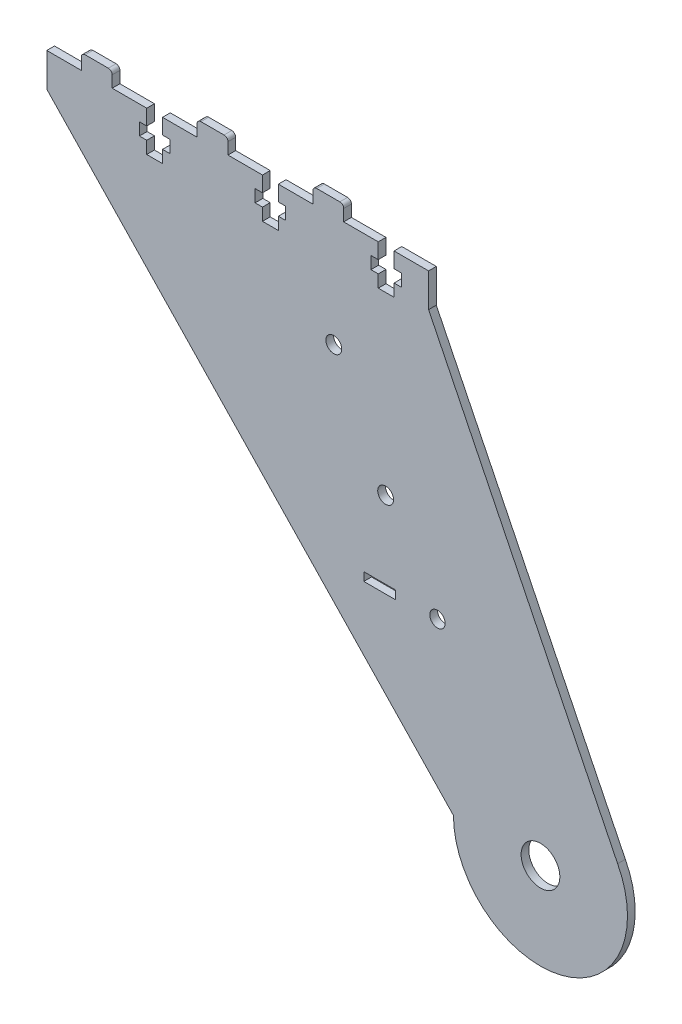
from build123d import *

# Parameters (mm, degrees)
SKETCH_1_R      = 2
SKETCH_1_R_2    = 5.02
SKETCH_1_R_3    = 2.05
SKETCH_1_W      = 8.2
SKETCH_1_H      = 2.2
EXTRUDE_1_DEPTH = 2
FILLET_1_R      = 1


with BuildPart() as part:
    # 草图1 → 凸台-拉伸1 (new body)
    with BuildSketch(Plane.XY):
        with BuildLine():
            Line((-38.25, 66.25), (-38.25, 62.25))
            Line((-38.25, 62.25), (-40.15, 62.25))
            Line((-40.15, 62.25), (-40.15, 59.05))
            Line((-40.15, 59.05), (-38.25, 59.05))
            Line((-38.25, 59.05), (-38.25, 55.85))
            Line((-38.25, 55.85), (-34.15, 55.85))
            Line((-34.15, 55.85), (-34.15, 59.05))
            Line((-34.15, 59.05), (-32.25, 59.05))
            Line((-32.25, 59.05), (-32.25, 62.25))
            Line((-32.25, 62.25), (-34.15, 62.25))
            Line((-34.15, 62.25), (-34.15, 66.25))
            Line((-34.15, 66.25), (-25.2, 66.25))
            Line((-25.2, 66.25), (-25.2, 70.25))
            Line((-25.2, 70.25), (-17.2, 70.25))
            Line((-17.2, 70.25), (-17.2, 66.25))
            Line((-17.2, 66.25), (-8.25, 66.25))
            Line((-8.25, 66.25), (-8.25, 62.25))
            Line((-8.25, 62.25), (-10.15, 62.25))
            Line((-10.15, 62.25), (-10.15, 59.05))
            Line((-10.15, 59.05), (-8.25, 59.05))
            Line((-8.25, 59.05), (-8.25, 55.85))
            Line((-8.25, 55.85), (-4.15, 55.85))
            Line((-4.15, 55.85), (-4.15, 59.05))
            Line((-4.15, 59.05), (-2.25, 59.05))
            Line((-2.25, 59.05), (-2.25, 62.25))
            Line((-2.25, 62.25), (-4.15, 62.25))
            Line((-4.15, 62.25), (-4.15, 66.25))
            Line((-4.15, 66.25), (4.8, 66.25))
            Line((4.8, 66.25), (4.8, 57.55))
            Line((4.8, 57.55), (53.793343317, -42.319549886))
            ThreePointArc((53.793343317, -42.319549886), (39.164608528, -74.656513398), (11.24, -52.75))
            Line((11.24, -52.75), (-94.15, 57.55))
            Line((-94.15, 57.55), (-94.15, 66.25))
            Line((-94.15, 66.25), (-85.2, 66.25))
            Line((-85.2, 66.25), (-85.2, 70.25))
            Line((-85.2, 70.25), (-77.2, 70.25))
            Line((-77.2, 70.25), (-77.2, 66.25))
            Line((-77.2, 66.25), (-68.25, 66.25))
            Line((-68.25, 66.25), (-68.25, 62.25))
            Line((-68.25, 62.25), (-70.15, 62.25))
            Line((-70.15, 62.25), (-70.15, 59.05))
            Line((-70.15, 59.05), (-68.25, 59.05))
            Line((-68.25, 59.05), (-68.25, 55.85))
            Line((-68.25, 55.85), (-64.15, 55.85))
            Line((-64.15, 55.85), (-64.15, 59.05))
            Line((-64.15, 59.05), (-62.25, 59.05))
            Line((-62.25, 59.05), (-62.25, 62.25))
            Line((-62.25, 62.25), (-64.15, 62.25))
            Line((-64.15, 62.25), (-64.15, 66.25))
            Line((-64.15, 66.25), (-55.2, 66.25))
            Line((-55.2, 66.25), (-55.2, 70.25))
            Line((-55.2, 70.25), (-47.2, 70.25))
            Line((-47.2, 70.25), (-47.2, 66.25))
            Line((-47.2, 66.25), (-38.25, 66.25))
        make_face()
        with Locations((7.098407643, -10.75)):
            Circle(SKETCH_1_R, mode=Mode.SUBTRACT)
        with Locations((33.795, -52.75)):
            Circle(SKETCH_1_R_2, mode=Mode.SUBTRACT)
        with Locations((-6.332168895, 10.336005166)):
            Circle(SKETCH_1_R_3, mode=Mode.SUBTRACT)
        with Locations((-19.762745434, 37.422010331)):
            Circle(SKETCH_1_R_3, mode=Mode.SUBTRACT)
        with Locations((-7.901592357, -10.75)):
            Rectangle(SKETCH_1_W, SKETCH_1_H, mode=Mode.SUBTRACT)
    extrude(amount=EXTRUDE_1_DEPTH)

    # 圆角1
    fillet_1_edges = [part.edges().sort_by_distance(p)[0] for p in [
        (-25.2, 70.25, 1),
        (-17.2, 70.25, 1),
        (-85.2, 70.25, 1),
        (-77.2, 70.25, 1),
        (-55.2, 70.25, 1),
        (-47.2, 70.25, 1),
    ]]
    fillet(fillet_1_edges, radius=FILLET_1_R)


solid = part.part
